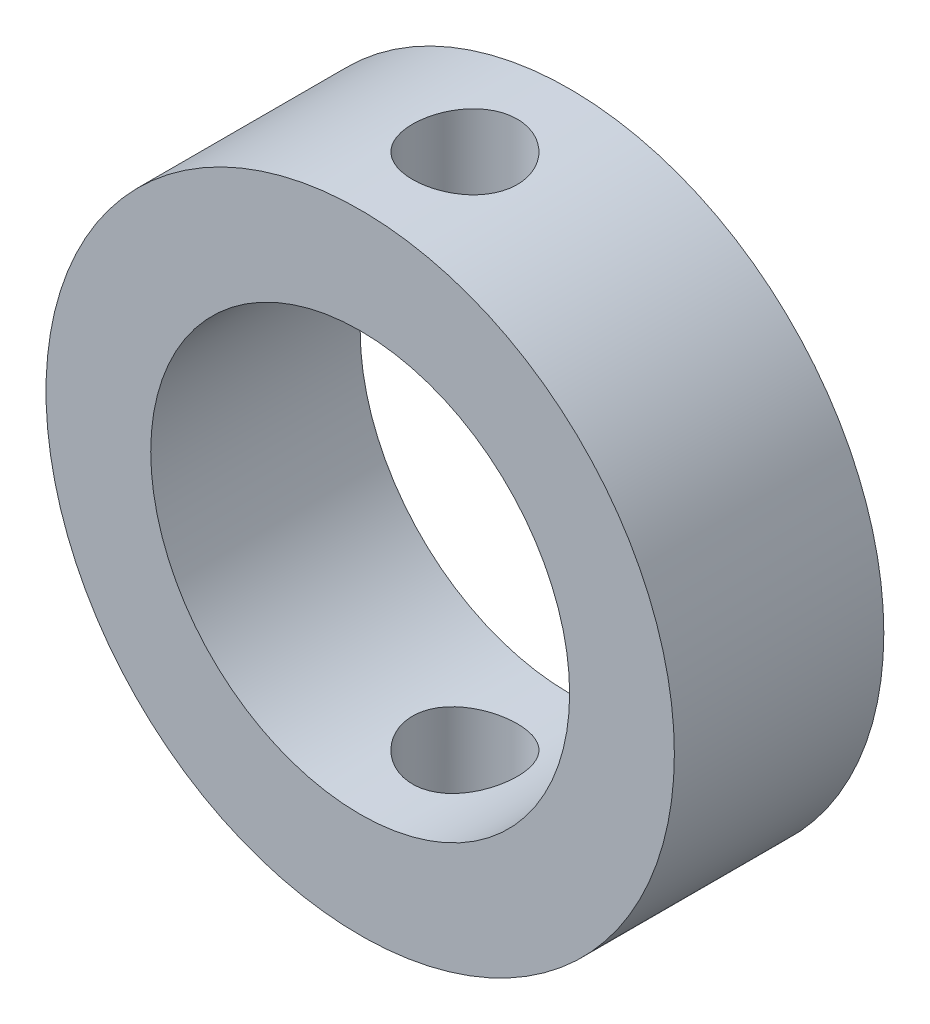
from build123d import *

# Parameters (mm, degrees)
SKETCH1_R               = 15
SKETCH1_R_2             = 10
BOSS_EXTRUDE1_DEPTH     = 10
CUT_EXTRUDE1_DEPTH      = 21
CUT_EXTRUDE1_DEPTH_BACK = 19
SKETCH2_R               = 2.5


with BuildPart() as part:
    # Sketch1 → Boss-Extrude1 (new body)
    with BuildSketch(Plane.XY):
        with Locations((0, 1.159893796)):
            Circle(SKETCH1_R)
        with Locations((0, 1.159893796)):
            Circle(SKETCH1_R_2, mode=Mode.SUBTRACT)
    extrude(amount=BOSS_EXTRUDE1_DEPTH)

    # Sketch2 → Cut-Extrude1 (cut, two sides: drawn at the far end of the back side and taken through both)
    with BuildSketch(Plane(origin=(0, 0, 0), x_dir=(1, 0, 0), z_dir=(0, 1, 0)).offset(-CUT_EXTRUDE1_DEPTH_BACK)):
        with Locations(Location((0, -5, 0), (0, 0, 90))):
            Circle(SKETCH2_R)
    extrude(amount=CUT_EXTRUDE1_DEPTH + CUT_EXTRUDE1_DEPTH_BACK, mode=Mode.SUBTRACT)


solid = part.part
